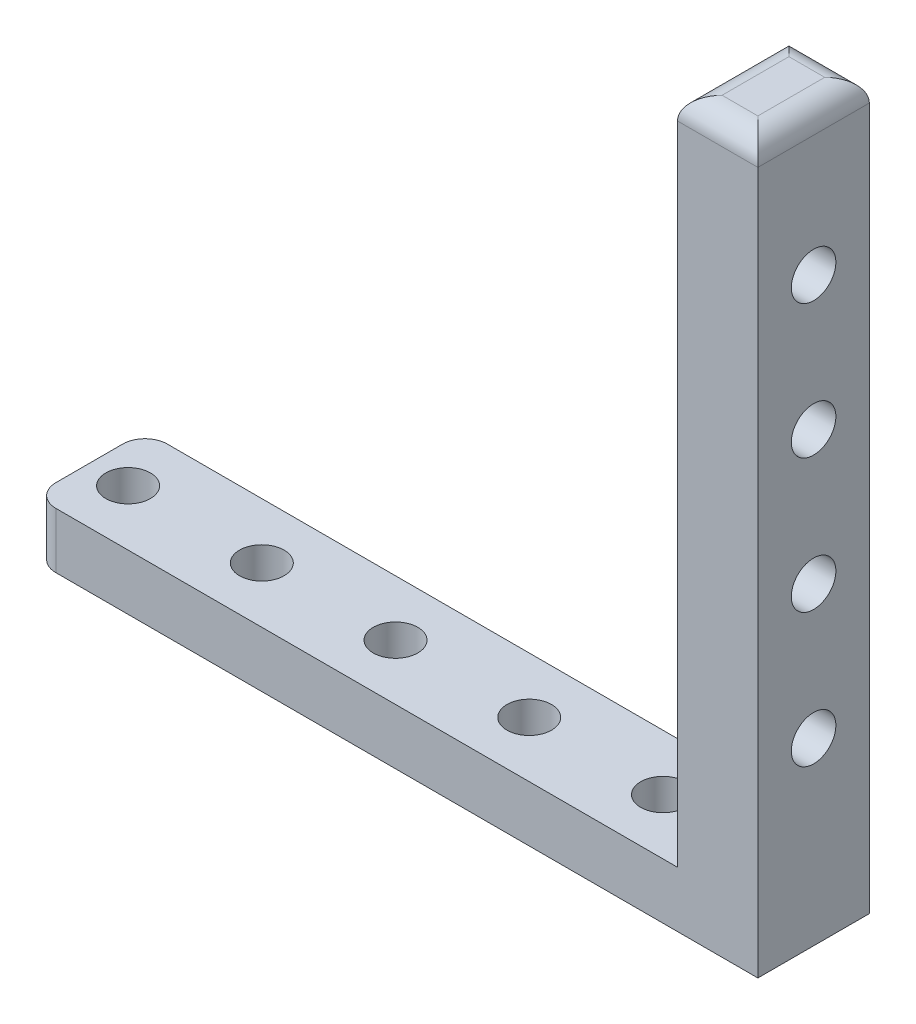
from build123d import *

# Parameters (mm, degrees)
SKETCH2_W           = 65
SKETCH2_H           = 10
BOSS_EXTRUDE1_DEPTH = 5
FILLET1_R           = 2
FILLET2_R           = 2
SKETCH3_R           = 2
CUT_EXTRUDE1_DEPTH  = 15
LPATTERN1_COUNT     = 5
LPATTERN1_PITCH     = 12
SKETCH4_W           = 7.213630723
SKETCH4_H           = 10
BOSS_EXTRUDE2_DEPTH = 60
SKETCH5_R           = 2
CUT_EXTRUDE2_DEPTH  = 60
LPATTERN2_COUNT     = 3
LPATTERN2_PITCH     = 12
LPATTERN2_COL_COUNT = 2
LPATTERN2_COL_PITCH = 12
FILLET3_R           = 2


with BuildPart() as part:
    # Sketch2 → Boss-Extrude1 (new body)
    with BuildSketch(Plane(origin=(0, 0, 0), x_dir=(1, 0, 0), z_dir=(0, 1, 0))):
        with Locations((-5.357142857, 0.803571429)):
            Rectangle(SKETCH2_W, SKETCH2_H)
    extrude(amount=BOSS_EXTRUDE1_DEPTH)

    # Fillet1
    fillet1_edges = [part.edges().sort_by_distance(p)[0] for p in [
        (-37.857142857, 2.5, 4.196428571),
    ]]
    fillet(fillet1_edges, radius=FILLET1_R)

    # Fillet2
    fillet2_edges = [part.edges().sort_by_distance(p)[0] for p in [
        (-37.857142857, 2.5, -5.803571429),
    ]]
    fillet(fillet2_edges, radius=FILLET2_R)

    # Sketch3 → Cut-Extrude1 (cut)
    with BuildSketch(Plane(origin=(0, 5, 0), x_dir=(1, 0, 0), z_dir=(0, 1, 0))):
        with Locations(Location((13.625145437, 0.803571429, 0), (0, 0, 270))):
            Circle(SKETCH3_R)
    cut_extrude1 = extrude(amount=-CUT_EXTRUDE1_DEPTH, mode=Mode.SUBTRACT)

    # LPattern1: Cut-Extrude1 ×5
    with Locations(*[(-i * LPATTERN1_PITCH, 0, 0) for i in range(1, LPATTERN1_COUNT)]):
        add(cut_extrude1, mode=Mode.SUBTRACT)

    # Sketch4 → Boss-Extrude2 (add)
    with BuildSketch(Plane(origin=(0, 5, 0), x_dir=(1, 0, 0), z_dir=(0, 1, 0))):
        with Locations((23.536041782, 0.803571429)):
            Rectangle(SKETCH4_W, SKETCH4_H)
    extrude(amount=BOSS_EXTRUDE2_DEPTH)

    # Sketch5 → Cut-Extrude2 (cut)
    with BuildSketch(Plane.ZY.offset(-19.92922642)):
        with Locations((-0.803571429, 28.14)):
            Circle(SKETCH5_R)
    cut_extrude2 = extrude(amount=-CUT_EXTRUDE2_DEPTH, mode=Mode.SUBTRACT)

    # LPattern2: Cut-Extrude2 ×3
    with Locations(*[(0, i * LPATTERN2_PITCH, 0) for i in range(1, LPATTERN2_COUNT)]):
        add(cut_extrude2, mode=Mode.SUBTRACT)

    # LPattern2 col: Cut-Extrude2 ×2
    with Locations(*[(0, -i * LPATTERN2_COL_PITCH, 0) for i in range(1, LPATTERN2_COL_COUNT)]):
        add(cut_extrude2, mode=Mode.SUBTRACT)

    # Fillet3
    fillet3_edges = [part.edges().sort_by_distance(p)[0] for p in [
        (27.142857143, 65, -0.803571429),
        (23.536041781, 65, -5.803571429),
        (19.92922642, 65, -0.803571429),
        (23.536041781, 65, 4.196428571),
    ]]
    fillet(fillet3_edges, radius=FILLET3_R)


solid = part.part
